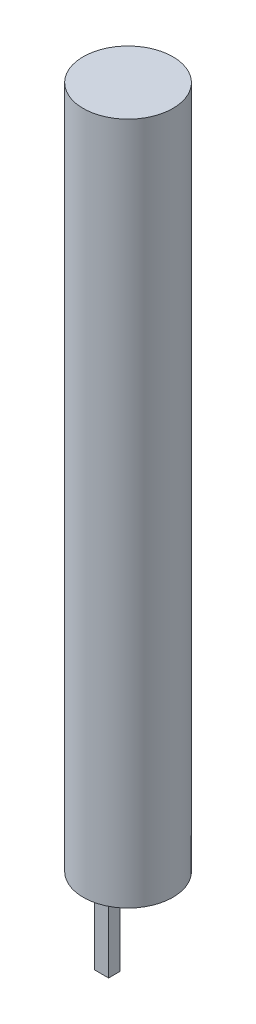
from build123d import *

# Parameters (mm, degrees)
SKETCH2_R           = 2.5
BOSS_EXTRUDE1_DEPTH = 38.1
SKETCH4_W           = 0.791244951
SKETCH4_H           = 0.623866212
BOSS_EXTRUDE3_DEPTH = 4


with BuildPart() as part:
    # Sketch2 → Boss-Extrude1 (new body)
    with BuildSketch(Plane(origin=(0, 0, 0), x_dir=(1, 0, 0), z_dir=(0, 1, 0))):
        Circle(SKETCH2_R)
    extrude(amount=BOSS_EXTRUDE1_DEPTH)

    # Sketch4 → Boss-Extrude3 (add)
    with BuildSketch(Plane.XZ):
        with Locations((0.205419362, 1.373266477)):
            Rectangle(SKETCH4_W, SKETCH4_H)
    extrude(amount=BOSS_EXTRUDE3_DEPTH)


solid = part.part
